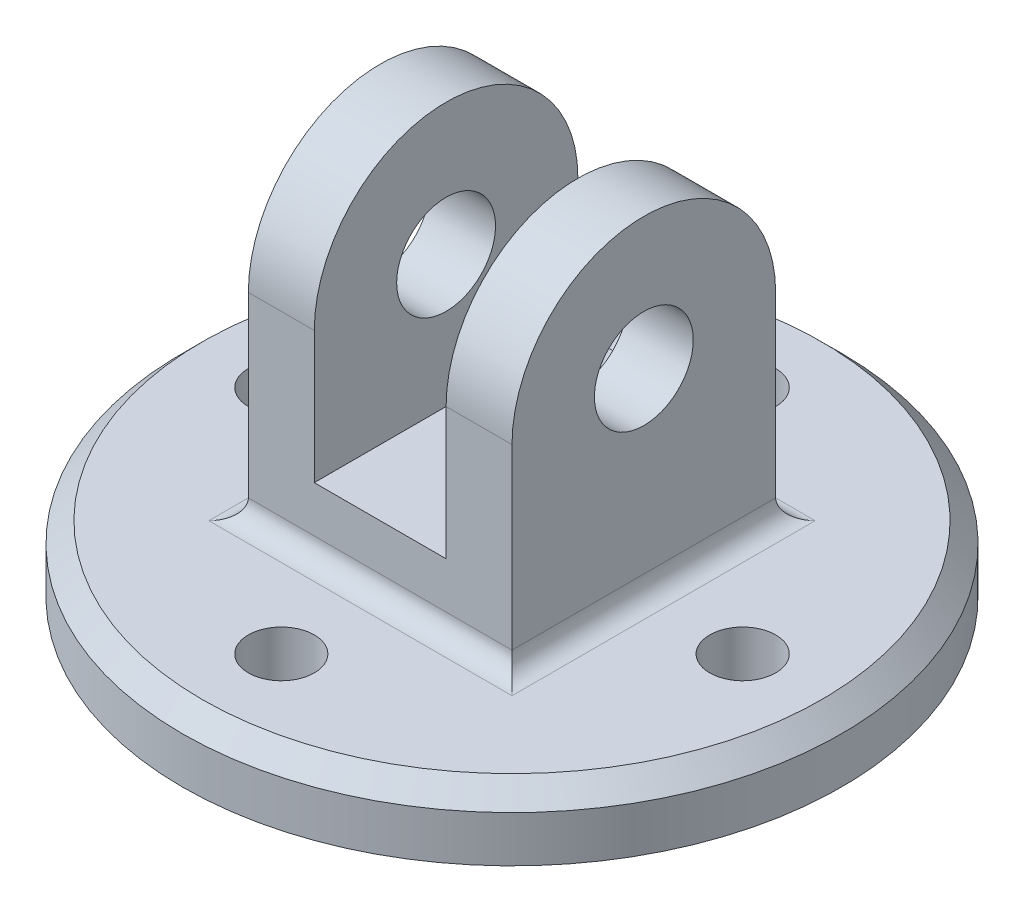
from build123d import *

# Parameters (mm, degrees)
SKETCH1_R           = 63.5
BASE_DEPTH          = 12.7
MOUNT_DEPTH         = 25.4
FILLET1_RADIUS      = 25.4
FILLET1_LENGTH      = 12.7
FILLET2_RADIUS      = 25.4
FILLET2_LENGTH      = 12.7
PIN_HOLE_DEPTH      = 118.774954893
PIN_HOLE_DEPTH_BACK = 118.774954893
SKETCH3_R           = 9.525
SKETCH4_R           = 6.35
BOLT_PATTERN_DEPTH  = 110.985226281
FILLET3_R           = 3.81
CHAMFER1_SIZE       = 3.81


with BuildPart() as part:
    # Sketch1 → Base (new body)
    with BuildSketch(Plane(origin=(0, 0, 0), x_dir=(1, 0, 0), z_dir=(0, 1, 0))):
        with Locations(Location((0, 0, 0), (0, 0, 270))):
            Circle(SKETCH1_R)
    extrude(amount=BASE_DEPTH)

    # Sketch2 → Mount (add, symmetric)
    with BuildSketch(Plane.XY):
        Polygon((-12.7, 25.4), (12.7, 25.4), (12.7, 76.2), (25.4, 76.2), (25.4, 12.7), (-25.4, 12.7), (-25.4, 76.2), (-12.7, 76.2), align=None)
    extrude(amount=MOUNT_DEPTH, both=True)

    # Fillet1: full round fillet: the end face becomes a half cylinder, R = half its width
    fillet1_face = Plane((19.05, 76.2, 0), x_dir=(-1, 0, 0), z_dir=(0, 1, 0))  # on the end face: x along it, z out of the body
    fillet1_slab = fillet1_face.offset(-FILLET1_RADIUS / 2) * Box(FILLET1_LENGTH, 2 * FILLET1_RADIUS, FILLET1_RADIUS, mode=Mode.PRIVATE)  # the body's end, R deep
    fillet1_round = Plane((19.05, 50.8, 0), x_dir=(0, 1, 0), z_dir=(-1, 0, 0)) * Cylinder(FILLET1_RADIUS, FILLET1_LENGTH, mode=Mode.PRIVATE)  # its axis R under the face
    add(fillet1_slab - fillet1_round, mode=Mode.SUBTRACT)

    # Fillet2: full round fillet: the end face becomes a half cylinder, R = half its width
    fillet2_face = Plane((-19.05, 76.2, 0), x_dir=(1, 0, 0), z_dir=(0, 1, 0))  # on the end face: x along it, z out of the body
    fillet2_slab = fillet2_face.offset(-FILLET2_RADIUS / 2) * Box(FILLET2_LENGTH, 2 * FILLET2_RADIUS, FILLET2_RADIUS, mode=Mode.PRIVATE)  # the body's end, R deep
    fillet2_round = Plane((-19.05, 50.8, 0), x_dir=(0, 1, 0), z_dir=(1, 0, 0)) * Cylinder(FILLET2_RADIUS, FILLET2_LENGTH, mode=Mode.PRIVATE)  # its axis R under the face
    add(fillet2_slab - fillet2_round, mode=Mode.SUBTRACT)

    # Sketch3 → Pin Hole (cut, two sides: drawn at the far end of the back side and taken through both)
    with BuildSketch(Plane(origin=(0, 0, 0), x_dir=(0, 0, -1), z_dir=(1, 0, 0)).offset(-PIN_HOLE_DEPTH_BACK)):
        with Locations((0, 50.8)):
            Circle(SKETCH3_R)
    extrude(amount=PIN_HOLE_DEPTH + PIN_HOLE_DEPTH_BACK, mode=Mode.SUBTRACT)

    # Sketch4 → Bolt Pattern (cut, through all)
    with BuildSketch(Plane(origin=(0, 12.7, 0), x_dir=(1, 0, 0), z_dir=(0, 1, 0))):
        with Locations(Location((0, -44.45, 0), (0, 0, 270))):
            Circle(SKETCH4_R)
        with Locations(Location((-44.45, 0, 0), (0, 0, 270))):
            Circle(SKETCH4_R)
        with Locations(Location((0, 44.45, 0), (0, 0, 270))):
            Circle(SKETCH4_R)
        with Locations(Location((44.45, 0, 0), (0, 0, 270))):
            Circle(SKETCH4_R)
    extrude(amount=-BOLT_PATTERN_DEPTH, mode=Mode.SUBTRACT)

    # Fillet3
    fillet3_edges = [part.edges().sort_by_distance(p)[0] for p in [
        (25.4, 12.7, 0),
        (0, 12.7, 25.4),
        (0, 12.7, -25.4),
        (-25.4, 12.7, 0),
    ]]
    fillet(fillet3_edges, radius=FILLET3_R)

    # Chamfer1
    chamfer1_edges = [part.edges().sort_by_distance(p)[0] for p in [
        (0, 12.7, -63.5),
    ]]
    chamfer(chamfer1_edges, length=CHAMFER1_SIZE)


solid = part.part
